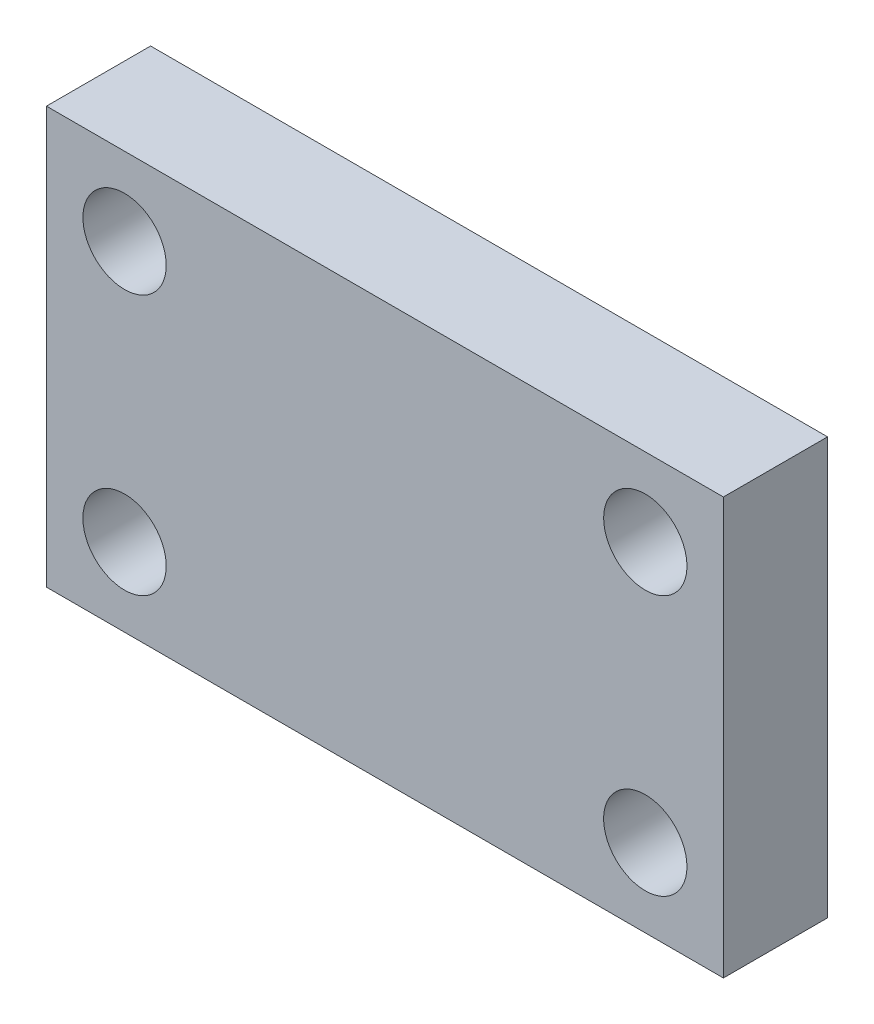
from build123d import *

# Parameters (mm, degrees)
ESBO_O2_W                = 130
ESBO_O2_H                = 80
ESBO_O2_R                = 8
RESSALTO_EXTRUS_O1_DEPTH = 20


with BuildPart() as part:
    # Esboço2 → Ressalto-extrusão1 (new body)
    with BuildSketch(Plane.XY):
        Rectangle(ESBO_O2_W, ESBO_O2_H)
        with Locations((-50, 25)):
            Circle(ESBO_O2_R, mode=Mode.SUBTRACT)
        with Locations(Location((50, 25, 0), (0, 0, 180))):
            Circle(ESBO_O2_R, mode=Mode.SUBTRACT)
        with Locations((50, -25)):
            Circle(ESBO_O2_R, mode=Mode.SUBTRACT)
        with Locations(Location((-50, -25, 0), (0, 0, 180))):
            Circle(ESBO_O2_R, mode=Mode.SUBTRACT)
    extrude(amount=RESSALTO_EXTRUS_O1_DEPTH)


solid = part.part
